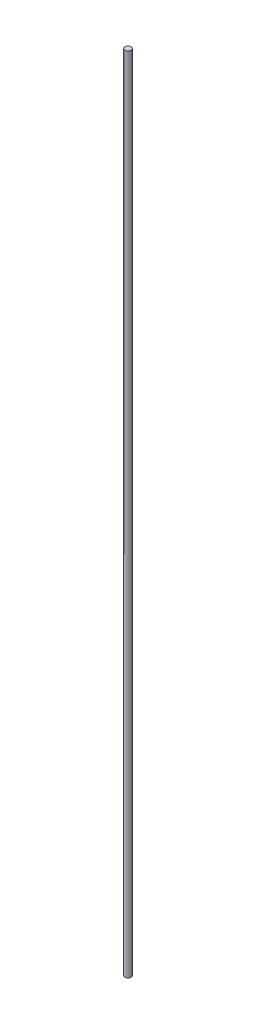
from build123d import *

# Parameters (mm, degrees)
SKETCH1_R           = 2
BOSS_EXTRUDE2_DEPTH = 520


with BuildPart() as part:
    # Sketch1 → Boss-Extrude2 (new body)
    with BuildSketch(Plane(origin=(0, 0, 0), x_dir=(1, 0, 0), z_dir=(0, 1, 0))):
        with Locations(Location((0, 0, 0), (0, 0, 270))):
            Circle(SKETCH1_R)
    extrude(amount=BOSS_EXTRUDE2_DEPTH)


solid = part.part
